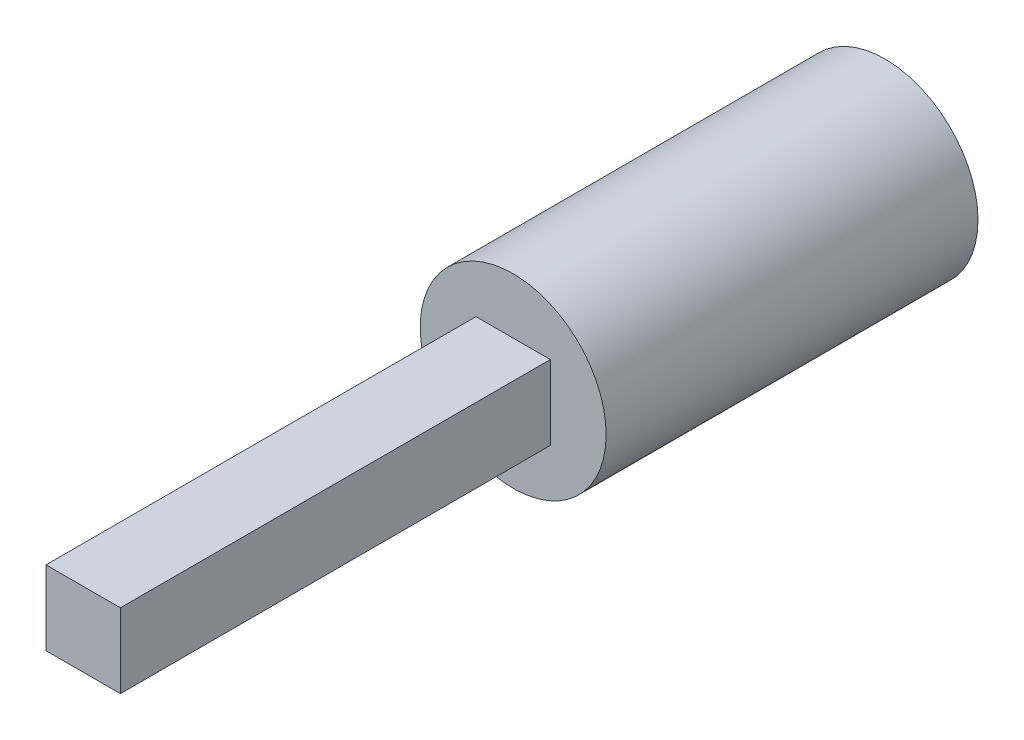
from build123d import *

# Parameters (mm, degrees)
SKETCH1_R           = 4
BOSS_EXTRUDE1_DEPTH = 16
CUT_EXTRUDE3_DEPTH  = 14
SKETCH6_W           = 3.2
SKETCH6_H           = 3.2
BOSS_EXTRUDE2_DEPTH = 18.5


with BuildPart() as part:
    # Sketch1 → Boss-Extrude1 (new body)
    with BuildSketch(Plane.XY):
        Circle(SKETCH1_R)
    extrude(amount=BOSS_EXTRUDE1_DEPTH)

    # Sketch3 → Cut-Extrude3 (cut)
    with BuildSketch(Plane(origin=(0, 0, 0), x_dir=(-1, 0, 0), z_dir=(0, 0, -1))):
        with BuildLine():
            Line((-1.658312395, -2.5), (1.658312395, -2.5))
            ThreePointArc((1.658312395, -2.5), (0, 3), (-1.658312395, -2.5))
        make_face()
    extrude(amount=-CUT_EXTRUDE3_DEPTH, mode=Mode.SUBTRACT)

    # Sketch6 → Boss-Extrude2 (add)
    with BuildSketch(Plane.XY.offset(16)):
        Rectangle(SKETCH6_W, SKETCH6_H)
    extrude(amount=BOSS_EXTRUDE2_DEPTH)


solid = part.part
